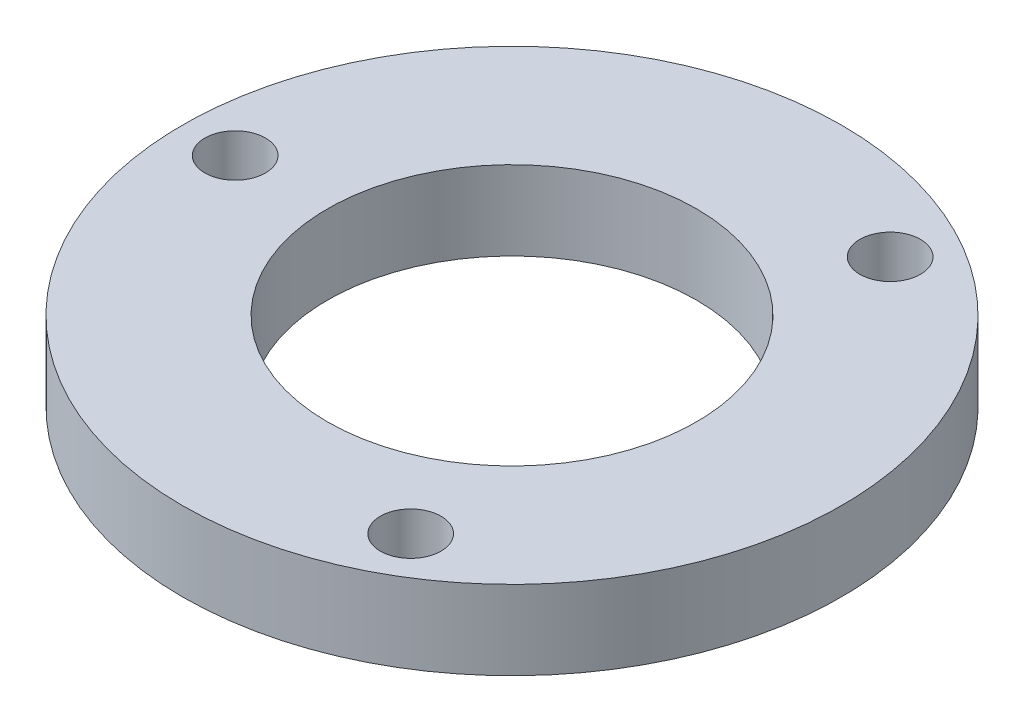
from build123d import *

# Parameters (mm, degrees)
SKETCH1_R           = 12.5
SKETCH1_R_2         = 7
BOSS_EXTRUDE1_DEPTH = 3
CUT_EXTRUDE1_REACH  = 19.93
SKETCH3_R           = 1.15


with BuildPart() as part:
    # Sketch1 → Boss-Extrude1 (new body)
    with BuildSketch(Plane(origin=(0, 0, 0), x_dir=(1, 0, 0), z_dir=(0, 1, 0))):
        with Locations(Location((0, 0, 0), (0, 0, 270))):
            Circle(SKETCH1_R)
        with Locations(Location((0, 0, 0), (0, 0, 270))):
            Circle(SKETCH1_R_2, mode=Mode.SUBTRACT)
    extrude(amount=BOSS_EXTRUDE1_DEPTH)

    # Sketch3 → Cut-Extrude1 (cut, up to next)
    with BuildSketch(Plane(origin=(0, 3, 0), x_dir=(1, 0, 0), z_dir=(0, 1, 0)), mode=Mode.PRIVATE) as cut_extrude1_sk1:
        with Locations(Location((-10.5, 0, 0), (0, 0, 270))):
            Circle(SKETCH3_R)
    cut_extrude1_tool1 = extrude(cut_extrude1_sk1.sketch, amount=-CUT_EXTRUDE1_REACH, mode=Mode.PRIVATE) & part.part
    # Sketch3 → Cut-Extrude1 (cut, up to next)
    with BuildSketch(Plane(origin=(0, 3, 0), x_dir=(1, 0, 0), z_dir=(0, 1, 0)), mode=Mode.PRIVATE) as cut_extrude1_sk2:
        with Locations(Location((5.25, 9.09326674, 0), (0, 0, 270))):
            Circle(SKETCH3_R)
    cut_extrude1_tool2 = extrude(cut_extrude1_sk2.sketch, amount=-CUT_EXTRUDE1_REACH, mode=Mode.PRIVATE) & part.part
    # Sketch3 → Cut-Extrude1 (cut, up to next)
    with BuildSketch(Plane(origin=(0, 3, 0), x_dir=(1, 0, 0), z_dir=(0, 1, 0)), mode=Mode.PRIVATE) as cut_extrude1_sk3:
        with Locations(Location((5.25, -9.09326674, 0), (0, 0, 270))):
            Circle(SKETCH3_R)
    cut_extrude1_tool3 = extrude(cut_extrude1_sk3.sketch, amount=-CUT_EXTRUDE1_REACH, mode=Mode.PRIVATE) & part.part
    add(cut_extrude1_tool1.solids().sort_by_distance((-10.5, 3, 0))[0], mode=Mode.SUBTRACT)
    add(cut_extrude1_tool2.solids().sort_by_distance((5.25, 3, -9.093267))[0], mode=Mode.SUBTRACT)
    add(cut_extrude1_tool3.solids().sort_by_distance((5.25, 3, 9.093267))[0], mode=Mode.SUBTRACT)


solid = part.part
